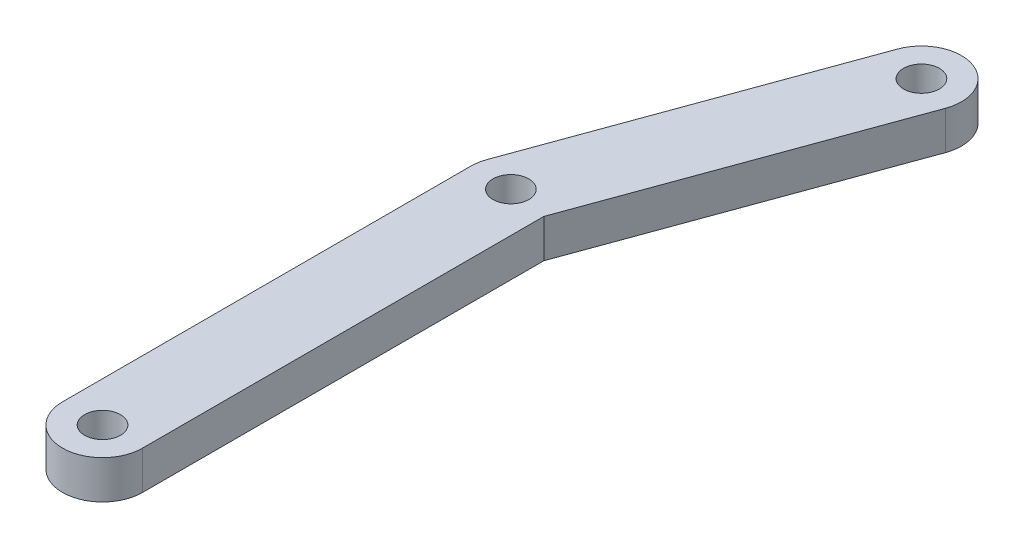
from build123d import *

# Parameters (mm, degrees)
SKETCH1_R           = 1.4224
BOSS_EXTRUDE1_DEPTH = 3.048


with BuildPart() as part:
    # Sketch1 → Boss-Extrude1 (new body)
    with BuildSketch(Plane(origin=(0, 0, 0), x_dir=(1, 0, 0), z_dir=(0, 1, 0))):
        with BuildLine():
            Line((-3.175, 32.38246), (-3.175, 0))
            ThreePointArc((-3.175, 0), (0, -3.175), (3.175, 0))
            Line((3.175, 0), (3.175, 31.822621836))
            Line((3.175, 31.822621836), (11.670835711, 55.164738613))
            ThreePointArc((11.670835711, 55.164738613), (9.773225596, 59.234176639), (5.703787569, 57.336566523))
            Line((5.703787569, 57.336566523), (-2.983524071, 33.468373955))
            ThreePointArc((-2.983524071, 33.468373955), (-3.126764616, 32.933792964), (-3.175, 32.38246))
        make_face()
        Circle(SKETCH1_R, mode=Mode.SUBTRACT)
        with Locations((0, 32.38246)):
            Circle(SKETCH1_R, mode=Mode.SUBTRACT)
        with Locations((8.68731164, 56.250652568)):
            Circle(SKETCH1_R, mode=Mode.SUBTRACT)
    extrude(amount=BOSS_EXTRUDE1_DEPTH)


solid = part.part
